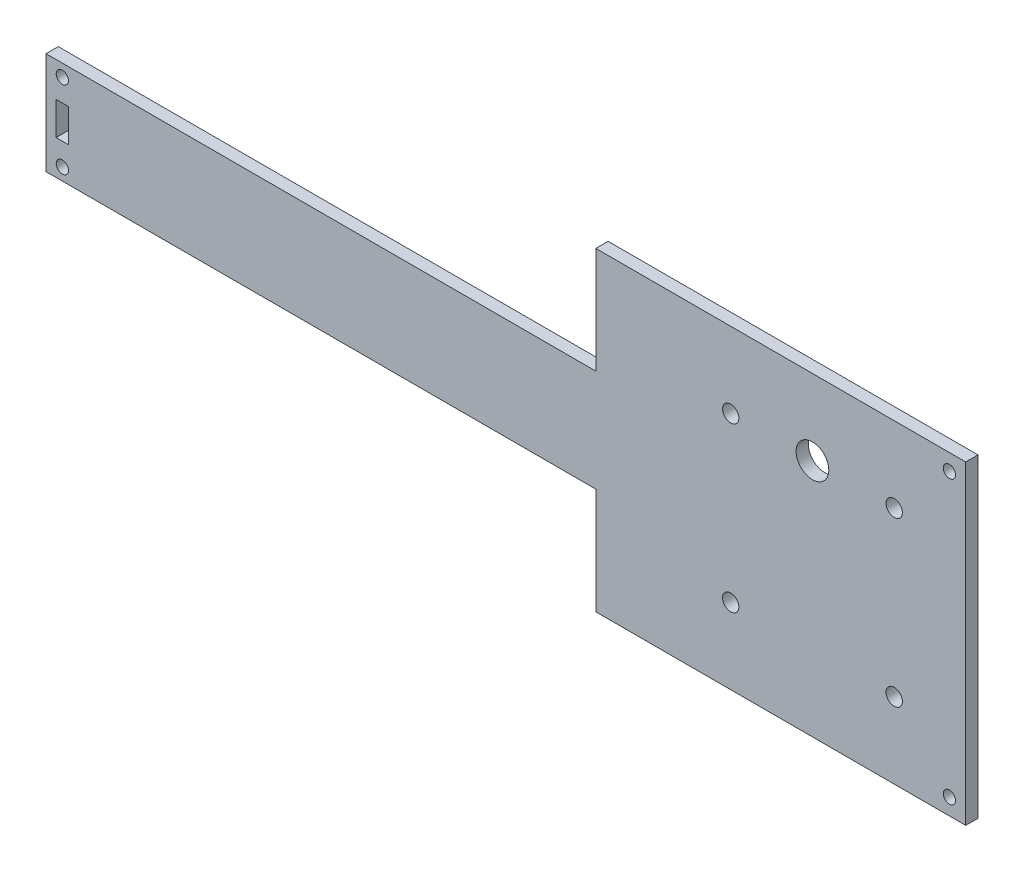
from build123d import *

# Parameters (mm, degrees)
SKETCH_1_R      = 1.5
SKETCH_1_R_2    = 2
SKETCH_1_R_3    = 4
SKETCH_1_W      = 3.1
SKETCH_1_H      = 8.1
EXTRUDE_1_DEPTH = 3


with BuildPart() as part:
    # 草图1 → 凸台-拉伸1 (new body)
    with BuildSketch(Plane.XY):
        Polygon((11.846846847, 25.617117117), (11.846846847, -51.382882883), (-78.647317431, -51.382882883), (-78.647317431, -25.382882883), (-213.153153153, -25.382882883), (-213.153153153, -0.382882883), (-78.647317431, -0.382882883), (-78.647317431, 25.617117117), align=None)
        with Locations((-209.153153153, -3.382882883)):
            Circle(SKETCH_1_R, mode=Mode.SUBTRACT)
        with Locations((7.846846847, 21.617117117)):
            Circle(SKETCH_1_R, mode=Mode.SUBTRACT)
        with Locations((-209.153153153, -22.382882883)):
            Circle(SKETCH_1_R, mode=Mode.SUBTRACT)
        with Locations((7.846846847, -47.382882883)):
            Circle(SKETCH_1_R, mode=Mode.SUBTRACT)
        with Locations((-5.653153153, -32.882882883)):
            Circle(SKETCH_1_R_2, mode=Mode.SUBTRACT)
        with Locations((-45.653153153, -32.882882883)):
            Circle(SKETCH_1_R_2, mode=Mode.SUBTRACT)
        with Locations((-45.653153153, 7.117117117)):
            Circle(SKETCH_1_R_2, mode=Mode.SUBTRACT)
        with Locations((-5.653153153, 7.117117117)):
            Circle(SKETCH_1_R_2, mode=Mode.SUBTRACT)
        with Locations((-25.653153153, 7.117117117)):
            Circle(SKETCH_1_R_3, mode=Mode.SUBTRACT)
        with Locations((-209.153153153, -12.882882883)):
            Rectangle(SKETCH_1_W, SKETCH_1_H, mode=Mode.SUBTRACT)
    extrude(amount=EXTRUDE_1_DEPTH)


solid = part.part
